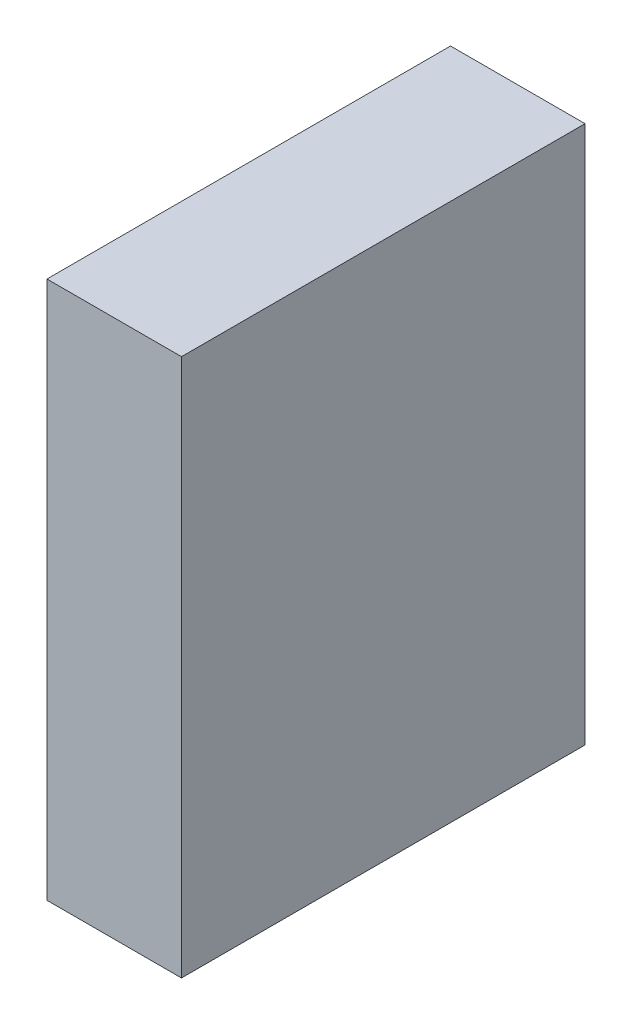
from build123d import *

# Parameters (mm, degrees)
SKETCH1_W           = 1000
SKETCH1_H           = 250
BOSS_EXTRUDE1_DEPTH = 750


with BuildPart() as part:
    # Sketch1 → Boss-Extrude1 (new body)
    with BuildSketch(Plane(origin=(0, 0, 0), x_dir=(0, 1, 0), z_dir=(0, 0, 1))):
        Rectangle(SKETCH1_W, SKETCH1_H)
    extrude(amount=BOSS_EXTRUDE1_DEPTH)


solid = part.part
